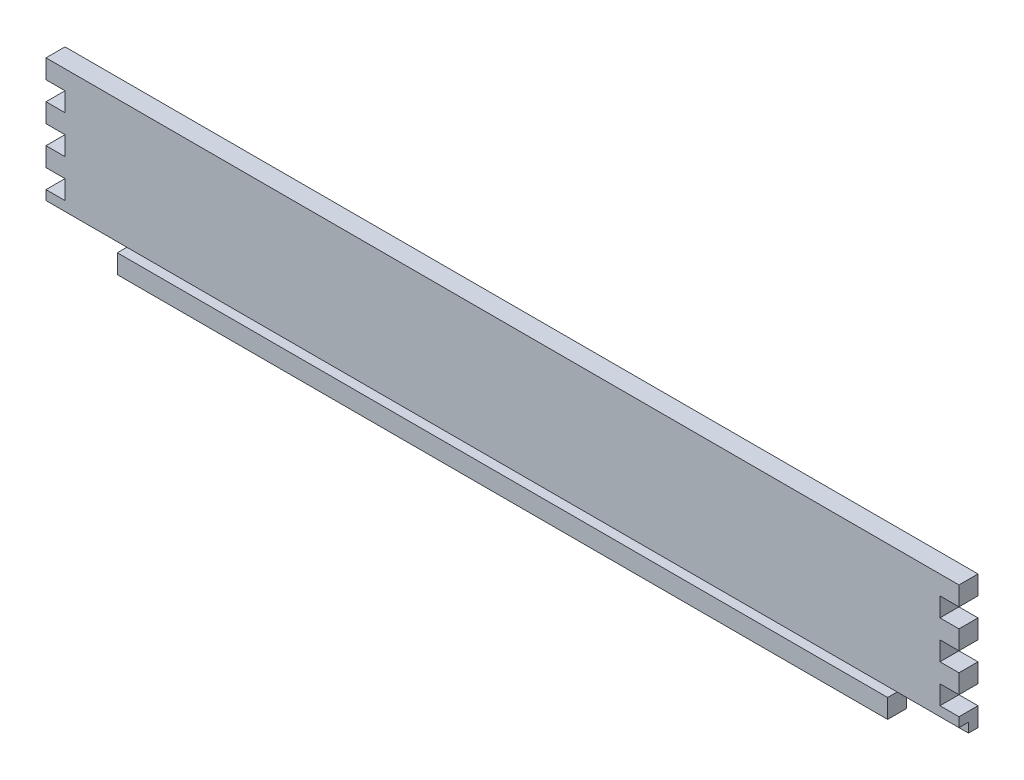
from build123d import *

# Parameters (mm, degrees)
BOSS_EXTRUDE1_DEPTH = 12.7
SKETCH2_W           = 34.925
SKETCH2_H           = 12.7
CUT_EXTRUDE1_DEPTH  = 619.139151001
SKETCH2_4_R         = 3.175
CUT_EXTRUDE2_DEPTH  = 6.35
SKETCH3_W           = 679.915177356
SKETCH3_H           = 6.35
CUT_EXTRUDE3_DEPTH  = 6.35


with BuildPart() as part:
    # Sketch1 → Boss-Extrude1 (new body)
    with BuildSketch(Plane.XY):
        Polygon((0, 25.4), (0, 12.7), (12.7, 12.7), (12.7, 0), (596.9, 0), (596.9, 12.7), (609.6, 12.7), (609.6, 25.4), (596.9, 25.4), (596.9, 38.1), (609.6, 38.1), (609.6, 50.8), (596.9, 50.8), (596.9, 63.5), (609.6, 63.5), (609.6, 76.2), (596.9, 76.2), (596.9, 88.9), (609.6, 88.9), (609.6, 101.6), (0, 101.6), (0, 88.9), (12.7, 88.9), (12.7, 76.2), (0, 76.2), (0, 63.5), (12.7, 63.5), (12.7, 50.8), (0, 50.8), (0, 38.1), (12.7, 38.1), (12.7, 25.4), align=None)
    extrude(amount=BOSS_EXTRUDE1_DEPTH)

    # Sketch2 → Cut-Extrude1 (cut, through all)
    with BuildSketch(Plane.XY):
        with Locations((579.4375, 6.35)):
            Rectangle(SKETCH2_W, SKETCH2_H)
        with Locations((30.1625, 6.35)):
            Rectangle(SKETCH2_W, SKETCH2_H)
    extrude(amount=CUT_EXTRUDE1_DEPTH, mode=Mode.SUBTRACT)

    # Sketch2<4> → Cut-Extrude2 (cut)
    with BuildSketch(Plane.XY):
        with Locations((589.75625, 23.8125)):
            Circle(SKETCH2_4_R)
        with Locations((19.84375, 23.8125)):
            Circle(SKETCH2_4_R)
    extrude(amount=CUT_EXTRUDE2_DEPTH, mode=Mode.SUBTRACT)

    # Sketch3 → Cut-Extrude3 (cut)
    with BuildSketch(Plane.XY.offset(12.7)):
        with Locations((325.163434952, 15.875)):
            Rectangle(SKETCH3_W, SKETCH3_H)
    extrude(amount=-CUT_EXTRUDE3_DEPTH, mode=Mode.SUBTRACT)


solid = part.part
